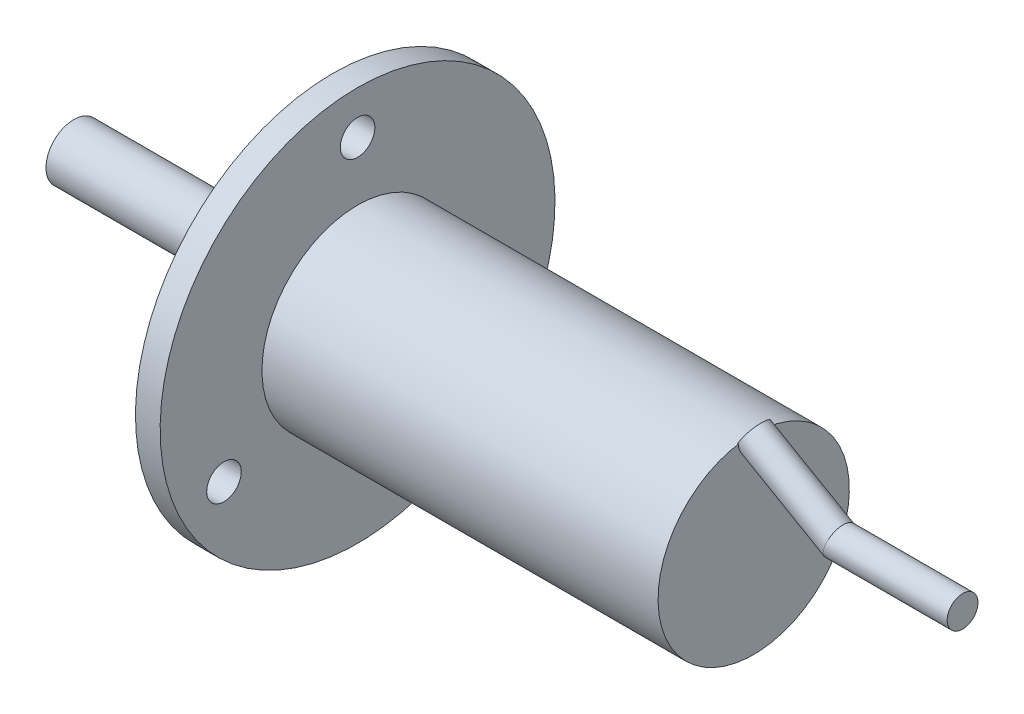
from build123d import *

# Parameters (mm, degrees)
SKETCH_2_R          = 2.25
EXTRUDE_1_DEPTH     = 15
SKETCH_3_R          = 1.4
CUT_EXTRUDE_1_DEPTH = 41.924442574
SWEEP_1_PROFILE_R   = 1.25


with BuildPart() as part:
    # 草图1 → 旋转1 (revolve)
    with BuildSketch(Plane.XY):
        Polygon((0, 0), (0, 3), (6, 3), (6, 16), (8, 16), (8, 7.75), (40.1, 7.75), (40.1, 0), align=None)
    revolve(axis=Axis((40.1, 0, 0), (-1, 0, 0)))

    # 草图3 → 切除-拉伸1 (cut, through all)
    with BuildSketch(Plane.ZY.offset(-6)):
        with Locations(Location((0, 12.5, 0), (0, 0, 270))):
            Circle(SKETCH_3_R)
        with Locations(Location((10.825317547, -6.25, 0), (0, 0, 270))):
            Circle(SKETCH_3_R)
        with Locations(Location((-10.825317547, -6.25, 0), (0, 0, 270))):
            Circle(SKETCH_3_R)
    extrude(amount=-CUT_EXTRUDE_1_DEPTH, mode=Mode.SUBTRACT)


with BuildPart() as body_2:
    # 草图2 → 凸台-拉伸1 (new body)
    with BuildSketch(Plane.ZY):
        with Locations(Location((0, 0, 0), (0, 0, 270))):
            Circle(SKETCH_2_R)
    extrude(amount=EXTRUDE_1_DEPTH)


with BuildPart() as body_3:
    # 扫描1: sweep along a path in 草图4
    with BuildLine(Plane.XY) as sweep_1_path:
        Line((40.1, 7.75), (47.02820323, 3.75))
        Line((47.02820323, 3.75), (57.02820323, 3.75))
    # 扫描1 profile (on start of the path) → 扫描1 (sweep)
    with BuildSketch(Plane(origin=(40.1, 7.75, 0), x_dir=(0.4999999999999976, 0.8660254037844402, 0), z_dir=(0.8660254037844402, -0.4999999999999976, 0))):
        Circle(SWEEP_1_PROFILE_R)
    sweep(path=sweep_1_path.line, transition=Transition.RIGHT)


solid = Compound([part.part, body_2.part, body_3.part])
